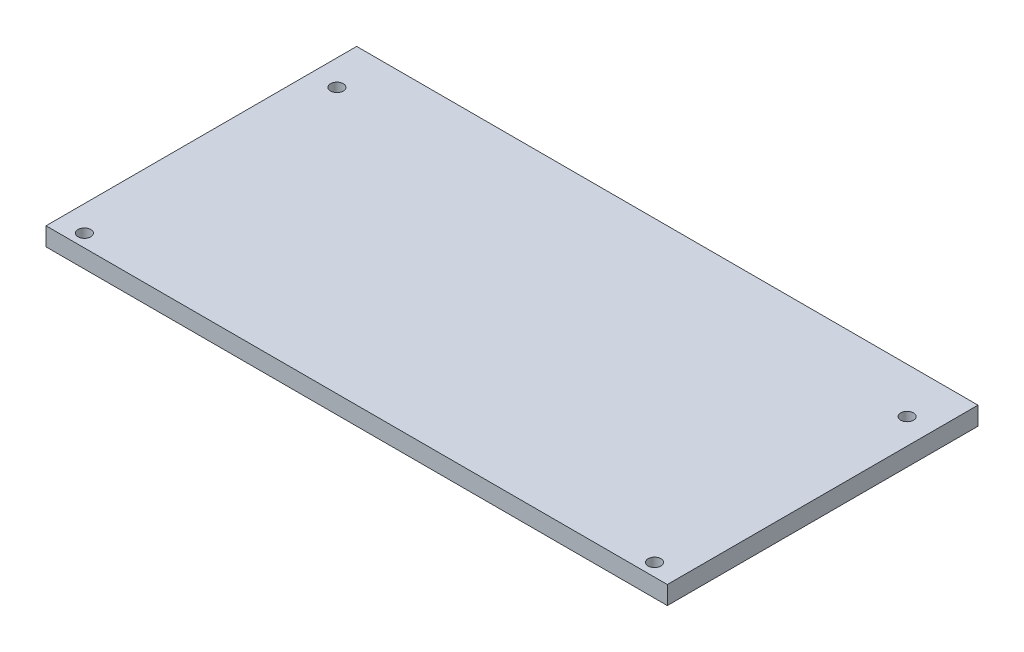
from build123d import *

# Parameters (mm, degrees)
SKETCH_2_W          = 170
SKETCH_2_H          = 85
EXTRUDE_1_DEPTH     = 5
SKETCH_4_R          = 1.75
CUT_EXTRUDE_1_DEPTH = 135.398260773


with BuildPart() as part:
    # 草图2 → 凸台-拉伸1 (new body)
    with BuildSketch(Plane(origin=(0, 0, 0), x_dir=(1, 0, 0), z_dir=(0, 1, 0))):
        with Locations((36.937172775, -13.795811518)):
            Rectangle(SKETCH_2_W, SKETCH_2_H)
    extrude(amount=EXTRUDE_1_DEPTH)

    # 草图4 → 切除-拉伸1 (cut, through all)
    with BuildSketch(Plane.XZ):
        with Locations(Location((-41.062827225, 52.795811518, 0), (0, 0, 270))):
            Circle(SKETCH_4_R)
        with Locations(Location((-41.062827225, -16.300372234, 0), (0, 0, 270))):
            Circle(SKETCH_4_R)
        with Locations(Location((114.937172775, -16.300372234, 0), (0, 0, 270))):
            Circle(SKETCH_4_R)
        with Locations(Location((114.937172775, 52.795811518, 0), (0, 0, 270))):
            Circle(SKETCH_4_R)
    extrude(amount=-CUT_EXTRUDE_1_DEPTH, mode=Mode.SUBTRACT)


solid = part.part
